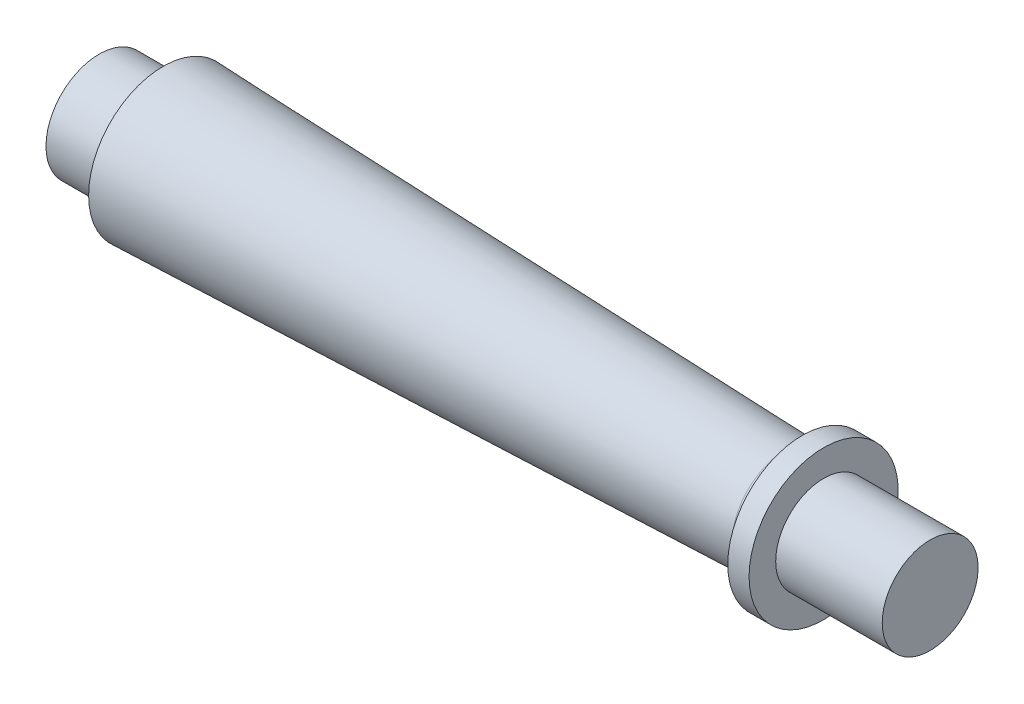
from build123d import *

# Parameters (mm, degrees)
FILLET2_R = 1.5


with BuildPart() as part:
    # Sketch1 → Revolve1 (revolve)
    with BuildSketch(Plane.XY, mode=Mode.PRIVATE) as revolve1_sk:
        Polygon((0, 0), (78, 0), (78, 4.5), (68, 4.5), (68, 7), (66, 7), (66, 5), (6, 7), (6, 5), (0, 5), align=None)
    revolve(revolve1_sk.sketch.rotate(Axis((0, 0, 0), (1, 0, 0)), 90), axis=Axis((0, 0, 0), (1, 0, 0)))

    # Fillet2
    fillet2_edges = [part.edges().sort_by_distance(p)[0] for p in [
        (66, 0, -5),
    ]]
    fillet(fillet2_edges, radius=FILLET2_R)


solid = part.part
